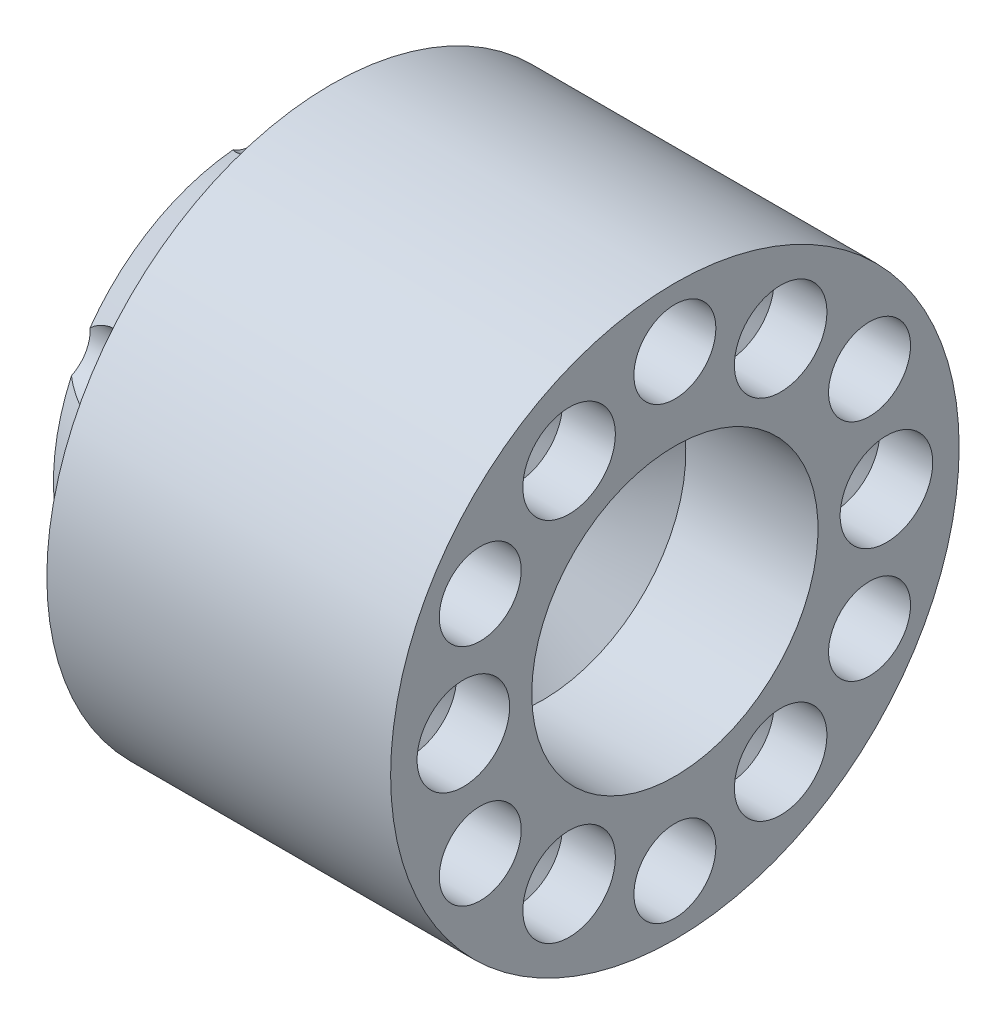
from build123d import *

# Parameters (mm, degrees)
SKETCH11_R                   = 3.1
EXTRUDE1_DEPTH               = 12
M6_TAPPED_HOLE1_D            = 5
M6_TAPPED_HOLE1_DEPTH        = 35
M6_TAPPED_HOLE1_TIP          = 1.502151548
F_7_0_7_DIAMETER_HOLE1_D     = 7
F_7_0_7_DIAMETER_HOLE1_DEPTH = 4
F_7_0_7_DIAMETER_HOLE1_TIP   = 2.103012167
EXTRUDE3_DEPTH               = 3.5


with BuildPart() as part:
    # Sketch1 → Revolve1 (revolve)
    with BuildSketch(Plane.XY, mode=Mode.PRIVATE) as revolve1_sk:
        Polygon((6, 18.5), (0, 15), (0, 8.2675), (17.675, 6.5), (22, 10.825), (32, 10.825), (32, 21.5), (6, 21.5), align=None)
    revolve(revolve1_sk.sketch.rotate(Axis((0, 0, 0), (1, 0, 0)), 90), axis=Axis((0, 0, 0), (1, 0, 0)))

    # Sketch11 → Extrude1 (cut)
    with BuildSketch(Plane(origin=(32, 0, 0), x_dir=(0, 0, -1), z_dir=(1, 0, 0))):
        with Locations((0, -17)):
            Circle(SKETCH11_R)
        with Locations((-14.722431864, -8.5)):
            Circle(SKETCH11_R)
        with Locations((-14.722431864, 8.5)):
            Circle(SKETCH11_R)
        with Locations((0, 17)):
            Circle(SKETCH11_R)
        with Locations((14.722431864, 8.5)):
            Circle(SKETCH11_R)
        with Locations((14.722431864, -8.5)):
            Circle(SKETCH11_R)
    extrude(amount=-EXTRUDE1_DEPTH, mode=Mode.SUBTRACT)

    # M6 Tapped Hole1
    with Locations(Plane(origin=(20, -17, 0), x_dir=(0, 0, 1), z_dir=(1, 0, 0))):
        with Locations((0, 0), (14.722431864, -8.5), (14.722431864, -25.5), (0, -34), (-14.722431864, -25.5), (-14.722431864, -8.5)):
            Hole(M6_TAPPED_HOLE1_D / 2, depth=M6_TAPPED_HOLE1_DEPTH)
            with Locations((0, 0, -(M6_TAPPED_HOLE1_DEPTH + M6_TAPPED_HOLE1_TIP / 2))):  # 118° drill point
                Cone(0, M6_TAPPED_HOLE1_D / 2, M6_TAPPED_HOLE1_TIP, mode=Mode.SUBTRACT)

    # Ø7.0 (7) Diameter Hole1
    with Locations(Plane(origin=(32, -13.856406461, -8), x_dir=(0, 0, 1), z_dir=(1, 0, 0))):
        with Locations((0, 0), (16, 0), (24, -13.856406461), (16, -27.712812922), (0, -27.712812922), (-8, -13.856406461)):
            Hole(F_7_0_7_DIAMETER_HOLE1_D / 2, depth=F_7_0_7_DIAMETER_HOLE1_DEPTH)
            with Locations((0, 0, -(F_7_0_7_DIAMETER_HOLE1_DEPTH + F_7_0_7_DIAMETER_HOLE1_TIP / 2))):  # 118° drill point
                Cone(0, F_7_0_7_DIAMETER_HOLE1_D / 2, F_7_0_7_DIAMETER_HOLE1_TIP, mode=Mode.SUBTRACT)

    # Sketch18 → Extrude3 (cut, symmetric)
    with BuildSketch(Plane.XY):
        Polygon((20.570558224, 5.305955372), (-1.084590537, 7.471470248), (-0.78607938, 10.456581818), (20.869069381, 8.291066942), align=None)
    extrude(amount=EXTRUDE3_DEPTH, both=True, mode=Mode.SUBTRACT)


solid = part.part
